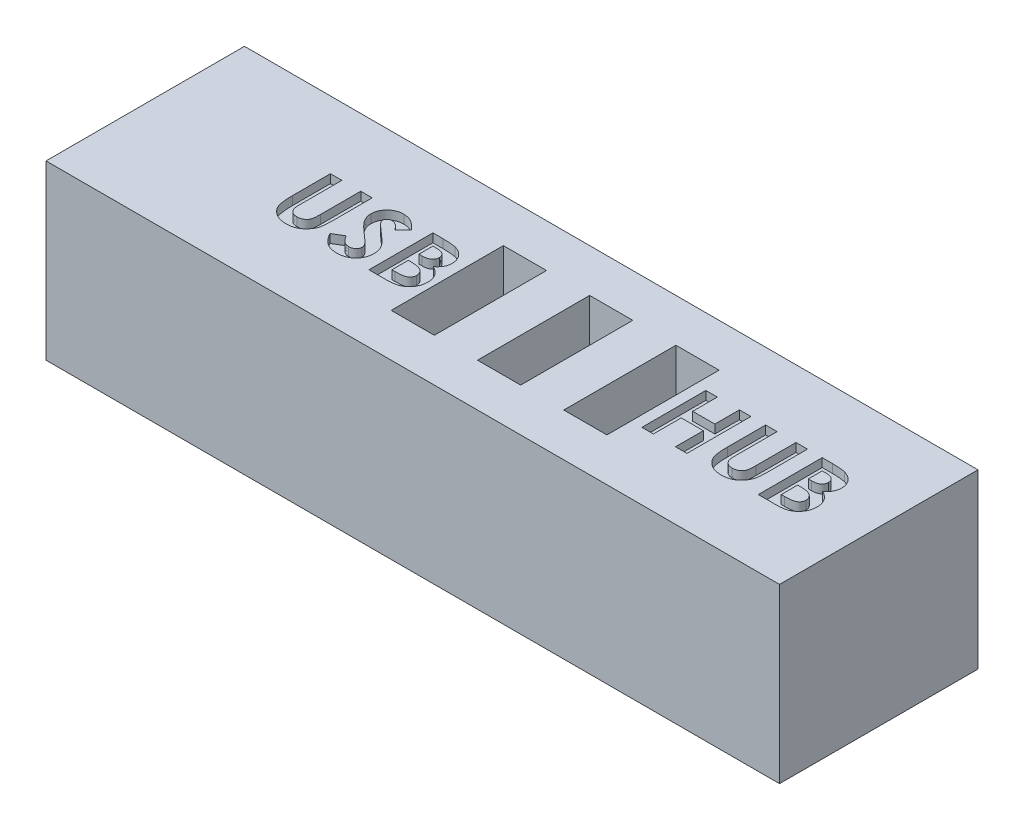
from build123d import *

# Parameters (mm, degrees)
SKETCH1_W           = 85
SKETCH1_H           = 23
BOSS_EXTRUDE1_DEPTH = 20
SKETCH2_W           = 5
SKETCH2_H           = 13
CUT_EXTRUDE1_DEPTH  = 10
CUT_EXTRUDE2_DEPTH  = 1


with BuildPart() as part:
    # Sketch1 → Boss-Extrude1 (new body)
    with BuildSketch(Plane(origin=(0, 0, 0), x_dir=(1, 0, 0), z_dir=(0, 1, 0))):
        Rectangle(SKETCH1_W, SKETCH1_H)
    extrude(amount=BOSS_EXTRUDE1_DEPTH)

    # Sketch2 → Cut-Extrude1 (cut)
    with BuildSketch(Plane(origin=(0, 20, 0), x_dir=(1, 0, 0), z_dir=(0, 1, 0))):
        with Locations((5, 0)):
            Rectangle(SKETCH2_W, SKETCH2_H)
        with Locations((-5, 0)):
            Rectangle(SKETCH2_W, SKETCH2_H)
        with Locations((15, 0)):
            Rectangle(SKETCH2_W, SKETCH2_H)
    extrude(amount=-CUT_EXTRUDE1_DEPTH, mode=Mode.SUBTRACT)

    # Sketch3 → Cut-Extrude2 (cut)
    # profile 1 of 6: a face of its own
    with BuildSketch(Plane(origin=(0, 20, 0), x_dir=(1, 0, 0), z_dir=(0, 1, 0))):
        with BuildLine():
            Line((-24.734192762, 3.694715282), (-23.404491907, 3.694715282))
            Line((-23.404491907, 3.694715282), (-23.404491907, -1.125450317))
            add(Edge.make_bspline(
                [(-23.404491907, -1.125450317), (-23.404419604, -1.175423703), (-23.404279953, -1.271946782), (-23.397288917, -1.410425799), (-23.390891637, -1.53771701), (-23.379349129, -1.653681058), (-23.362296888, -1.758367549), (-23.345784754, -1.852448951), (-23.323437214, -1.934240844), (-23.289852434, -2.027341432), (-23.238109313, -2.131945027), (-23.153563925, -2.240965294), (-23.056005779, -2.340462111), (-22.939076722, -2.423279492), (-22.807658803, -2.490271288), (-22.662474105, -2.539904796), (-22.503727286, -2.567494436), (-22.393962569, -2.5717065), (-22.337466333, -2.573874462)],
                knots=[0, 0, 0, 0, 1.155499968, 2.231836252, 3.205919964, 4.102923608, 4.924856345, 5.658536265, 6.31071849, 6.882491295, 7.94666036, 8.992281882, 10.060072772, 11.158554251, 12.289267114, 13.461410017, 14.693379945, 16, 16, 16, 16], degree=3))
            add(Edge.make_bspline(
                [(-22.337466333, -2.573874462), (-22.277446053, -2.572123027), (-22.16041667, -2.568708025), (-21.992088532, -2.535186083), (-21.836131558, -2.48180767), (-21.695847889, -2.405623072), (-21.571377129, -2.31430248), (-21.466015239, -2.210168388), (-21.382864022, -2.0930131), (-21.328669153, -1.984928425), (-21.298241402, -1.885445894), (-21.275434288, -1.796562028), (-21.258714149, -1.691687864), (-21.243545091, -1.572461239), (-21.234429655, -1.437647194), (-21.224545451, -1.288329921), (-21.220922798, -1.123487752), (-21.220305344, -1.008705056), (-21.21998336, -0.948849422)],
                knots=[0, 0, 0, 0, 1.261321664, 2.459363699, 3.594844139, 4.716940403, 5.803436589, 6.833651888, 7.818396249, 8.814403945, 9.360733334, 10.004355033, 10.743453831, 11.592799886, 12.532235708, 13.585170094, 14.740740724, 16, 16, 16, 16], degree=3))
            Line((-21.21998336, -0.948849422), (-21.21998336, 3.694715282))
            Line((-21.21998336, 3.694715282), (-19.890282505, 3.694715282))
            Line((-19.890282505, 3.694715282), (-19.890282505, -0.724759211))
            add(Edge.make_bspline(
                [(-19.890282505, -0.724759211), (-19.890467158, -0.814297553), (-19.890822228, -0.986471052), (-19.896275033, -1.233896487), (-19.907883066, -1.459879933), (-19.917632476, -1.664487421), (-19.936500922, -1.847443313), (-19.956157416, -2.009528881), (-19.981211309, -2.150169731), (-20.018489996, -2.310272247), (-20.082821973, -2.494624431), (-20.186533554, -2.70689798), (-20.318188693, -2.914726642), (-20.473798488, -3.115824159), (-20.649496181, -3.302637271), (-20.841386177, -3.466635003), (-21.046419822, -3.6053594), (-21.26673957, -3.715418483), (-21.502157918, -3.801256271), (-21.755004155, -3.85893494), (-22.02510586, -3.897903374), (-22.211670213, -3.901646771), (-22.30778551, -3.903575317)],
                knots=[0, 0, 0, 0, 1.170808336, 2.251350247, 3.235597562, 4.129743112, 4.929140599, 5.639994148, 6.264258765, 6.79612947, 7.788252245, 8.809469599, 9.879094798, 10.999557536, 12.129761673, 13.226370002, 14.293821979, 15.358369427, 16.438775801, 17.562147481, 18.744053101, 20, 20, 20, 20], degree=3))
            add(Edge.make_bspline(
                [(-22.30778551, -3.903575317), (-22.371646426, -3.902499664), (-22.497642703, -3.900377423), (-22.682942331, -3.881664802), (-22.862070822, -3.854089435), (-23.034691594, -3.813859814), (-23.201403782, -3.761890657), (-23.362163094, -3.697920245), (-23.516372109, -3.622305396), (-23.663167896, -3.535741602), (-23.80236981, -3.442137761), (-23.929593174, -3.338373963), (-24.049216043, -3.232123933), (-24.157782561, -3.118916218), (-24.25610816, -2.999939306), (-24.343990339, -2.874923557), (-24.421298533, -2.743880075), (-24.489977388, -2.604446809), (-24.548759784, -2.44953687), (-24.598315553, -2.273640046), (-24.641608639, -2.073999332), (-24.673781506, -1.850164947), (-24.702949616, -1.602874624), (-24.721411421, -1.331484134), (-24.731069622, -1.035985691), (-24.73312541, -0.831122746), (-24.734192762, -0.724759211)],
                knots=[0, 0, 0, 0, 1.001158378, 1.975264943, 2.917723546, 3.841610987, 4.75185031, 5.653588123, 6.552117133, 7.442167995, 8.324307438, 9.179605724, 10.014504199, 10.831958861, 11.636465792, 12.43274043, 13.225645099, 14.020104002, 14.867201867, 15.819789774, 16.883317127, 18.068162734, 19.364263498, 20.787406516, 22.332041935, 24, 24, 24, 24], degree=3))
            Line((-24.734192762, -0.724759211), (-24.734192762, 3.694715282))
        make_face()
    # profile 2 of 6: a face of its own
    with BuildSketch(Plane(origin=(0, 20, 0), x_dir=(1, 0, 0), z_dir=(0, 1, 0))):
        with BuildLine():
            Line((-14.381521821, 2.704859846), (-15.37582938, 1.795142632))
            add(Edge.make_bspline(
                [(-15.37582938, 1.795142632), (-15.418421253, 1.855222896), (-15.500191708, 1.970568624), (-15.632733087, 2.125019273), (-15.764675974, 2.25677717), (-15.897242739, 2.365291892), (-16.031608403, 2.449904132), (-16.167539729, 2.509810532), (-16.304266082, 2.5478936), (-16.396125085, 2.552635858), (-16.441370913, 2.554971692)],
                knots=[0, 0, 0, 0, 1.299362458, 2.494594718, 3.587462134, 4.587049575, 5.512617175, 6.380583204, 7.202344345, 8, 8, 8, 8], degree=3))
            add(Edge.make_bspline(
                [(-16.441370913, 2.554971692), (-16.483574924, 2.5534916), (-16.56505978, 2.550633932), (-16.681222487, 2.522228924), (-16.784353393, 2.473206051), (-16.874351846, 2.409104521), (-16.945643899, 2.331877038), (-17.002565075, 2.250885265), (-17.03461648, 2.161488665), (-17.038835076, 2.100087474), (-17.040923531, 2.069690242)],
                knots=[0, 0, 0, 0, 1.185010067, 2.2879431, 3.333075148, 4.379039566, 5.372662701, 6.27520591, 7.14612461, 8, 8, 8, 8], degree=3))
            add(Edge.make_bspline(
                [(-17.040923531, 2.069690242), (-17.039614802, 2.038854668), (-17.036979204, 1.976756108), (-17.011522913, 1.885742934), (-16.973153015, 1.796812469), (-16.936489011, 1.742676263), (-16.917748117, 1.715004411)],
                knots=[0, 0, 0, 0, 0.967525499, 1.948461899, 2.951351359, 4, 4, 4, 4], degree=3))
            add(Edge.make_bspline(
                [(-16.917748117, 1.715004411), (-16.900710617, 1.69349537), (-16.861492542, 1.643984398), (-16.786711705, 1.565566737), (-16.69280268, 1.469498237), (-16.576151648, 1.359082414), (-16.441601116, 1.230348282), (-16.282914492, 1.08835643), (-16.104659469, 0.928709534), (-15.977959928, 0.817537216), (-15.911568229, 0.759281922)],
                knots=[0, 0, 0, 0, 0.473873513, 1.090794244, 1.870441696, 2.795289791, 3.865433203, 5.087734844, 6.473946851, 8, 8, 8, 8], degree=3))
            add(Edge.make_bspline(
                [(-15.911568229, 0.759281922), (-15.849250069, 0.705348697), (-15.730983148, 0.602994643), (-15.562712805, 0.457719496), (-15.414831199, 0.327018989), (-15.285184032, 0.212854656), (-15.175736628, 0.114028653), (-15.086028871, 0.030068591), (-15.014965133, -0.03739098), (-14.974569558, -0.078136602), (-14.957329781, -0.095525771)],
                knots=[0, 0, 0, 0, 1.543621617, 2.929473131, 4.163658386, 5.240097082, 6.164993805, 6.925417477, 7.541396219, 8, 8, 8, 8], degree=3))
            add(Edge.make_bspline(
                [(-14.957329781, -0.095525771), (-14.89192566, -0.166307036), (-14.766195972, -0.302373487), (-14.6027917, -0.513233693), (-14.468304698, -0.719076249), (-14.364263003, -0.923774417), (-14.28568653, -1.130281584), (-14.230289076, -1.343662327), (-14.197111173, -1.566146342), (-14.193427651, -1.717964522), (-14.191564557, -1.794752867)],
                knots=[0, 0, 0, 0, 1.206664779, 2.319633467, 3.337109185, 4.282041471, 5.190008762, 6.099243693, 7.03861361, 8, 8, 8, 8], degree=3))
            add(Edge.make_bspline(
                [(-14.191564557, -1.794752867), (-14.192890659, -1.869573693), (-14.195492522, -2.016374937), (-14.227360352, -2.231196691), (-14.272802007, -2.436790432), (-14.343062777, -2.630919011), (-14.428696188, -2.81676899), (-14.536050037, -2.991445415), (-14.662122411, -3.156716084), (-14.80662071, -3.309626582), (-14.966452987, -3.44838226), (-15.137888294, -3.571905842), (-15.322603012, -3.673890293), (-15.519018968, -3.757867214), (-15.727031024, -3.822547361), (-15.946391376, -3.870352018), (-16.17743555, -3.89904362), (-16.335426885, -3.902042987), (-16.416142214, -3.903575317)],
                knots=[0, 0, 0, 0, 1.043214005, 2.046824704, 3.02475056, 3.976699089, 4.921714032, 5.875962561, 6.831408892, 7.817874052, 8.806269674, 9.781291748, 10.760897367, 11.74438705, 12.757449933, 13.795994037, 14.874007457, 16, 16, 16, 16], degree=3))
            add(Edge.make_bspline(
                [(-16.416142214, -3.903575317), (-16.47950306, -3.902451253), (-16.604993871, -3.900224962), (-16.789948356, -3.882049153), (-16.968542819, -3.85271533), (-17.140576089, -3.810671198), (-17.306823207, -3.757395582), (-17.467291001, -3.692321457), (-17.620871707, -3.6144402), (-17.768727391, -3.525353358), (-17.910139291, -3.4219118), (-18.046895505, -3.306230354), (-18.17763764, -3.176529788), (-18.302993625, -3.033116839), (-18.422161397, -2.875585396), (-18.539041744, -2.706129375), (-18.648440153, -2.521603904), (-18.716020417, -2.392157793), (-18.750538915, -2.326039593)],
                knots=[0, 0, 0, 0, 1.016823716, 2.013894106, 2.979844003, 3.91962641, 4.853723003, 5.779685073, 6.695824784, 7.614987388, 8.547259901, 9.504950863, 10.487499108, 11.500346958, 12.559593716, 13.656357062, 14.802919212, 16, 16, 16, 16], degree=3))
            Line((-18.750538915, -2.326039593), (-17.581114503, -1.624088137))
            add(Edge.make_bspline(
                [(-17.581114503, -1.624088137), (-17.537937021, -1.699140933), (-17.455162096, -1.843023557), (-17.314892249, -2.036348098), (-17.171192951, -2.201898567), (-17.020742004, -2.336748848), (-16.865368835, -2.442702062), (-16.704322956, -2.51842358), (-16.537491218, -2.565295114), (-16.423853017, -2.57101921), (-16.367168857, -2.573874462)],
                knots=[0, 0, 0, 0, 1.283663364, 2.460892379, 3.537111102, 4.529833553, 5.449777664, 6.316464042, 7.160231139, 8, 8, 8, 8], degree=3))
            add(Edge.make_bspline(
                [(-16.367168857, -2.573874462), (-16.30951295, -2.571542709), (-16.197652095, -2.567018768), (-16.037985037, -2.525232493), (-15.891596234, -2.459624977), (-15.765058833, -2.366012097), (-15.65791494, -2.257968606), (-15.578836597, -2.137765282), (-15.529159049, -2.007708187), (-15.523906927, -1.917361974), (-15.521265411, -1.871923006)],
                knots=[0, 0, 0, 0, 1.13588714, 2.203786484, 3.234766741, 4.283437687, 5.291419208, 6.222934724, 7.106237994, 8, 8, 8, 8], degree=3))
            add(Edge.make_bspline(
                [(-15.521265411, -1.871923006), (-15.523704743, -1.829649441), (-15.528660013, -1.743774739), (-15.565158999, -1.616092866), (-15.622218049, -1.488469061), (-15.689722927, -1.383788563), (-15.758417594, -1.29614242), (-15.82410519, -1.220201001), (-15.904095305, -1.136299029), (-15.99818512, -1.04433096), (-16.105131463, -0.943487176), (-16.225024422, -0.833777553), (-16.359236898, -0.716168501), (-16.454098541, -0.636054377), (-16.503700641, -0.594163591)],
                knots=[0, 0, 0, 0, 0.916159276, 1.861089862, 2.860218735, 3.940849679, 4.552606315, 5.27541173, 6.11797699, 7.06649574, 8.129236253, 9.306560635, 10.591630461, 12, 12, 12, 12], degree=3))
            add(Edge.make_bspline(
                [(-16.503700641, -0.594163591), (-16.597996207, -0.5143805), (-16.77897794, -0.361252599), (-17.03472809, -0.135087511), (-17.265181874, 0.076284488), (-17.468348847, 0.275476417), (-17.64681767, 0.458809662), (-17.799379674, 0.627773327), (-17.924358897, 0.783670735), (-18.05587258, 0.968320782), (-18.180836873, 1.193329552), (-18.288841484, 1.464041186), (-18.358910318, 1.734718471), (-18.366760556, 1.916436292), (-18.370624386, 2.005876473)],
                knots=[0, 0, 0, 0, 1.345494975, 2.582412109, 3.71882943, 4.751509156, 5.681369928, 6.505683931, 7.230279997, 7.856715994, 8.973648664, 10.023341002, 11.027102913, 12, 12, 12, 12], degree=3))
            add(Edge.make_bspline(
                [(-18.370624386, 2.005876473), (-18.369017424, 2.069302649), (-18.365851537, 2.194259028), (-18.337611336, 2.377989177), (-18.295405279, 2.555273333), (-18.234109968, 2.725464683), (-18.154556055, 2.888350056), (-18.057940918, 3.044726843), (-17.942764307, 3.193155788), (-17.812968042, 3.333538493), (-17.66996579, 3.46183231), (-17.51714971, 3.575064459), (-17.355384755, 3.670701978), (-17.185660522, 3.750040245), (-17.0069253, 3.810768648), (-16.820495823, 3.853815968), (-16.626104691, 3.87941914), (-16.49388404, 3.882899594), (-16.426530502, 3.884672547)],
                knots=[0, 0, 0, 0, 1.010766082, 1.991317756, 2.957454644, 3.913069143, 4.869106762, 5.843196583, 6.838735724, 7.860187025, 8.887984031, 9.89767229, 10.887916223, 11.879572884, 12.879850636, 13.892031539, 14.926195476, 16, 16, 16, 16], degree=3))
            add(Edge.make_bspline(
                [(-16.426530502, 3.884672547), (-16.33924365, 3.881479408), (-16.165358959, 3.875118335), (-15.908265428, 3.825376827), (-15.657147216, 3.747153066), (-15.454791454, 3.652784705), (-15.293780752, 3.561370028), (-15.170381089, 3.477206909), (-15.04481529, 3.380793533), (-14.916070744, 3.271826076), (-14.786539725, 3.148251447), (-14.652539046, 3.013011438), (-14.51589463, 2.86493726), (-14.427097425, 2.759153753), (-14.381521821, 2.704859846)],
                knots=[0, 0, 0, 0, 1.282922637, 2.555718331, 3.837320111, 5.142675274, 5.830281639, 6.55870424, 7.337177975, 8.157850921, 9.037902056, 9.96903443, 10.957596896, 12, 12, 12, 12], degree=3))
        make_face()
    # profile 3 of 6: a face of its own
    with BuildSketch(Plane(origin=(0, 20, 0), x_dir=(1, 0, 0), z_dir=(0, 1, 0))):
        with BuildLine():
            Line((-12.861863702, -3.713618052), (-12.861863702, 3.694715282))
            Line((-12.861863702, 3.694715282), (-11.674630796, 3.694715282))
            add(Edge.make_bspline(
                [(-11.674630796, 3.694715282), (-11.591517069, 3.694724767), (-11.430693583, 3.694743121), (-11.198667264, 3.686595118), (-10.983482449, 3.676054764), (-10.785823938, 3.664262559), (-10.605355304, 3.643942234), (-10.442350978, 3.62252683), (-10.296485276, 3.596701174), (-10.20630444, 3.573534759), (-10.163876923, 3.562635621)],
                knots=[0, 0, 0, 0, 1.311965854, 2.538629056, 3.664479157, 4.713267157, 5.663616078, 6.530575999, 7.308677837, 8, 8, 8, 8], degree=3))
            add(Edge.make_bspline(
                [(-10.163876923, 3.562635621), (-10.108165286, 3.547262192), (-9.998841169, 3.517094589), (-9.842254146, 3.456169812), (-9.693709512, 3.388447602), (-9.553388636, 3.311189227), (-9.422153144, 3.223461962), (-9.300501776, 3.124569575), (-9.185810812, 3.018481605), (-9.082152667, 2.902241408), (-8.988462783, 2.779412108), (-8.907063072, 2.650025889), (-8.836337155, 2.516061151), (-8.779737897, 2.375832037), (-8.737091419, 2.22998434), (-8.705899963, 2.079140852), (-8.685683676, 1.922824267), (-8.683773502, 1.816476985), (-8.682803873, 1.762493727)],
                knots=[0, 0, 0, 0, 1.099996261, 2.158545794, 3.195537121, 4.207578794, 5.205712374, 6.197378256, 7.190519799, 8.17788031, 9.159561366, 10.129234751, 11.085776129, 12.040971148, 13.00380137, 13.975669004, 14.972423361, 16, 16, 16, 16], degree=3))
            add(Edge.make_bspline(
                [(-8.682803873, 1.762493727), (-8.685339165, 1.69313941), (-8.690329575, 1.556623959), (-8.722208659, 1.35610746), (-8.781986906, 1.166590547), (-8.86020529, 0.984580495), (-8.966557837, 0.810756204), (-9.101605003, 0.645200322), (-9.263159467, 0.482815134), (-9.387080658, 0.385476167), (-9.451537179, 0.334846158)],
                knots=[0, 0, 0, 0, 0.986156485, 1.941127874, 2.875419072, 3.804401753, 4.751181392, 5.761612777, 6.835722519, 8, 8, 8, 8], degree=3))
            add(Edge.make_bspline(
                [(-9.451537179, 0.334846158), (-9.399304707, 0.308181934), (-9.29689128, 0.255900767), (-9.1514943, 0.169966136), (-9.016872569, 0.078563757), (-8.892422482, -0.016467317), (-8.780754522, -0.119155591), (-8.677257734, -0.223584026), (-8.587038109, -0.335735936), (-8.506361002, -0.451614015), (-8.436237772, -0.57289619), (-8.375168171, -0.699377643), (-8.32358487, -0.831490463), (-8.279902796, -0.9685623), (-8.247324693, -1.11106462), (-8.226083078, -1.259048386), (-8.20981917, -1.412008899), (-8.20855399, -1.516201781), (-8.20791071, -1.569178615)],
                knots=[0, 0, 0, 0, 1.164658916, 2.283573913, 3.35186032, 4.395461096, 5.390182219, 6.362969632, 7.312859996, 8.245001507, 9.165155236, 10.092416118, 11.032087915, 11.979892451, 12.947605196, 13.931445124, 14.948243989, 16, 16, 16, 16], degree=3))
            add(Edge.make_bspline(
                [(-8.20791071, -1.569178615), (-8.212085167, -1.67036134), (-8.220323441, -1.870045042), (-8.28055768, -2.163226577), (-8.384984711, -2.441189264), (-8.525208681, -2.70282836), (-8.69799159, -2.940569842), (-8.896642387, -3.148829317), (-9.119161115, -3.325116339), (-9.324461536, -3.444096403), (-9.502030232, -3.523943152), (-9.649107066, -3.573309447), (-9.807064468, -3.619042309), (-9.978795838, -3.651156868), (-10.161187921, -3.680551645), (-10.356019051, -3.698700588), (-10.562925093, -3.71099968), (-10.705037106, -3.712727616), (-10.778269952, -3.713618052)],
                knots=[0, 0, 0, 0, 1.284142165, 2.534249414, 3.780121997, 5.041676246, 6.291546858, 7.49970053, 8.684500223, 9.883330709, 10.50184324, 11.153274765, 11.851151195, 12.587658647, 13.369265475, 14.195992086, 15.070362669, 16, 16, 16, 16], degree=3))
            Line((-10.778269952, -3.713618052), (-12.861863702, -3.713618052))
        make_face()
        with BuildLine():
            Line((-11.532162847, 2.365014427), (-11.532162847, 0.750377675))
            Line((-11.532162847, 0.750377675), (-11.178961058, 0.750377675))
            add(Edge.make_bspline(
                [(-11.178961058, 0.750377675), (-11.130957761, 0.750796282), (-11.038290302, 0.751604377), (-10.904441987, 0.762012364), (-10.77998467, 0.779769036), (-10.66539039, 0.804544061), (-10.559591661, 0.83600473), (-10.463264354, 0.87385869), (-10.376832005, 0.920044635), (-10.276417605, 0.98884064), (-10.170272343, 1.09007704), (-10.076833863, 1.236333996), (-10.021799222, 1.404528939), (-10.015669847, 1.523153036), (-10.012504727, 1.584408791)],
                knots=[0, 0, 0, 0, 1.065314748, 2.056525647, 2.977365736, 3.853934255, 4.656397591, 5.425096493, 6.14721249, 6.826394842, 8.123232004, 9.372140726, 10.643011755, 12, 12, 12, 12], degree=3))
            add(Edge.make_bspline(
                [(-10.012504727, 1.584408791), (-10.015037403, 1.641784984), (-10.019934229, 1.752719547), (-10.075347036, 1.908481552), (-10.161414081, 2.046518568), (-10.263028325, 2.140993617), (-10.35871788, 2.20551729), (-10.44065315, 2.248003381), (-10.530583261, 2.286036495), (-10.630249164, 2.315117541), (-10.739081712, 2.336938934), (-10.856552244, 2.352964134), (-10.982863438, 2.363871567), (-11.070106849, 2.364625302), (-11.115147289, 2.365014427)],
                knots=[0, 0, 0, 0, 1.347982417, 2.606269829, 3.849316587, 5.153353503, 5.842674298, 6.568177932, 7.326619318, 8.142485038, 9.012069166, 9.942760135, 10.937925643, 12, 12, 12, 12], degree=3))
            Line((-11.115147289, 2.365014427), (-11.532162847, 2.365014427))
        make_face(mode=Mode.SUBTRACT)
        with BuildLine():
            Line((-11.532162847, -0.484344547), (-11.532162847, -2.383917197))
            Line((-11.532162847, -2.383917197), (-11.149280235, -2.383917197))
            add(Edge.make_bspline(
                [(-11.149280235, -2.383917197), (-11.073583855, -2.383484746), (-10.928048119, -2.382653306), (-10.719568435, -2.372607531), (-10.530008282, -2.35450179), (-10.359869923, -2.331898232), (-10.20889276, -2.301273946), (-10.07758713, -2.262339092), (-9.964152348, -2.21950397), (-9.869268574, -2.166597509), (-9.791753967, -2.105027507), (-9.721805161, -2.042101487), (-9.664773263, -1.969510378), (-9.619648561, -1.890370315), (-9.580593211, -1.806647194), (-9.557037782, -1.715071658), (-9.539103505, -1.618357785), (-9.538116533, -1.551462891), (-9.537611565, -1.517237175)],
                knots=[0, 0, 0, 0, 1.753078804, 3.370512758, 4.83203934, 6.162291463, 7.344201807, 8.395507345, 9.331626367, 10.147333109, 10.898971645, 11.62040215, 12.321813352, 13.025280112, 13.727906689, 14.453419512, 15.208716525, 16, 16, 16, 16], degree=3))
            add(Edge.make_bspline(
                [(-9.537611565, -1.517237175), (-9.538725165, -1.478099531), (-9.540894158, -1.401869929), (-9.558608351, -1.290452229), (-9.590800826, -1.186436414), (-9.631348819, -1.087162659), (-9.687773506, -0.996185309), (-9.754832317, -0.910355985), (-9.835856481, -0.832581131), (-9.92697288, -0.758156634), (-10.033251139, -0.692993955), (-10.154741119, -0.636453788), (-10.292102821, -0.589233524), (-10.445761737, -0.551636718), (-10.615044239, -0.519728828), (-10.801185902, -0.500676296), (-11.002636475, -0.48650609), (-11.142325581, -0.485081433), (-11.214578045, -0.484344547)],
                knots=[0, 0, 0, 0, 0.845221588, 1.646264278, 2.427170338, 3.19324141, 3.95557735, 4.731569926, 5.540061037, 6.376114724, 7.268642756, 8.224665384, 9.265483498, 10.400594375, 11.639216012, 12.983232105, 14.439614077, 16, 16, 16, 16], degree=3))
            Line((-11.214578045, -0.484344547), (-11.532162847, -0.484344547))
        make_face(mode=Mode.SUBTRACT)
    # profile 4 of 6: a face of its own
    with BuildSketch(Plane(origin=(0, 20, 0), x_dir=(1, 0, 0), z_dir=(0, 1, 0))):
        Polygon((18.766020914, 3.694715282), (20.095721768, 3.694715282), (20.095721768, 0.845356307), (22.660144845, 0.845356307), (22.660144845, 3.694715282), (23.9898457, 3.694715282), (23.9898457, -3.713618052), (22.660144845, -3.713618052), (22.660144845, -0.484344547), (20.095721768, -0.484344547), (20.095721768, -3.713618052), (18.766020914, -3.713618052), align=None)
    # profile 5 of 6: a face of its own
    with BuildSketch(Plane(origin=(0, 20, 0), x_dir=(1, 0, 0), z_dir=(0, 1, 0))):
        with BuildLine():
            Line((25.699461085, 3.694715282), (27.029161939, 3.694715282))
            Line((27.029161939, 3.694715282), (27.029161939, -1.125450317))
            add(Edge.make_bspline(
                [(27.029161939, -1.125450317), (27.029234242, -1.175423703), (27.029373893, -1.271946782), (27.036364929, -1.410425799), (27.042762209, -1.53771701), (27.054304717, -1.653681058), (27.071356958, -1.758367549), (27.087869092, -1.852448951), (27.110216632, -1.934240844), (27.143801412, -2.027341432), (27.195544533, -2.131945027), (27.280089921, -2.240965294), (27.377648067, -2.340462111), (27.494577124, -2.423279492), (27.625995043, -2.490271288), (27.771179741, -2.539904796), (27.92992656, -2.567494436), (28.039691277, -2.5717065), (28.096187513, -2.573874462)],
                knots=[0, 0, 0, 0, 1.155499968, 2.231836252, 3.205919964, 4.102923608, 4.924856345, 5.658536265, 6.31071849, 6.882491295, 7.94666036, 8.992281882, 10.060072772, 11.158554251, 12.289267114, 13.461410017, 14.693379945, 16, 16, 16, 16], degree=3))
            add(Edge.make_bspline(
                [(28.096187513, -2.573874462), (28.156207793, -2.572123027), (28.273237176, -2.568708025), (28.441565314, -2.535186083), (28.597522288, -2.48180767), (28.737805957, -2.405623072), (28.862276717, -2.31430248), (28.967638607, -2.210168388), (29.050789824, -2.0930131), (29.104984694, -1.984928425), (29.135412444, -1.885445894), (29.158219559, -1.796562028), (29.174939697, -1.691687864), (29.190108756, -1.572461239), (29.199224191, -1.437647194), (29.209108395, -1.288329921), (29.212731048, -1.123487752), (29.213348503, -1.008705056), (29.213670486, -0.948849422)],
                knots=[0, 0, 0, 0, 1.261321664, 2.459363699, 3.594844139, 4.716940403, 5.803436589, 6.833651888, 7.818396249, 8.814403945, 9.360733334, 10.004355033, 10.743453831, 11.592799886, 12.532235708, 13.585170094, 14.740740724, 16, 16, 16, 16], degree=3))
            Line((29.213670486, -0.948849422), (29.213670486, 3.694715282))
            Line((29.213670486, 3.694715282), (30.543371341, 3.694715282))
            Line((30.543371341, 3.694715282), (30.543371341, -0.724759211))
            add(Edge.make_bspline(
                [(30.543371341, -0.724759211), (30.543186688, -0.814297553), (30.542831618, -0.986471052), (30.537378814, -1.233896487), (30.52577078, -1.459879933), (30.51602137, -1.664487421), (30.497152924, -1.847443313), (30.47749643, -2.009528881), (30.452442537, -2.150169731), (30.41516385, -2.310272247), (30.350831873, -2.494624431), (30.247120292, -2.70689798), (30.115465153, -2.914726642), (29.959855358, -3.115824159), (29.784157666, -3.302637271), (29.592267669, -3.466635003), (29.387234024, -3.6053594), (29.166914276, -3.715418483), (28.931495928, -3.801256271), (28.678649691, -3.85893494), (28.408547986, -3.897903374), (28.221983634, -3.901646771), (28.125868336, -3.903575317)],
                knots=[0, 0, 0, 0, 1.170808336, 2.251350247, 3.235597562, 4.129743112, 4.929140599, 5.639994148, 6.264258765, 6.79612947, 7.788252245, 8.809469599, 9.879094798, 10.999557536, 12.129761673, 13.226370002, 14.293821979, 15.358369427, 16.438775801, 17.562147481, 18.744053101, 20, 20, 20, 20], degree=3))
            add(Edge.make_bspline(
                [(28.125868336, -3.903575317), (28.06200742, -3.902499664), (27.936011144, -3.900377423), (27.750711515, -3.881664802), (27.571583024, -3.854089435), (27.398962252, -3.813859814), (27.232250064, -3.761890657), (27.071490752, -3.697920245), (26.917281737, -3.622305396), (26.77048595, -3.535741602), (26.631284036, -3.442137761), (26.504060672, -3.338373963), (26.384437804, -3.232123933), (26.275871285, -3.118916218), (26.177545686, -2.999939306), (26.089663508, -2.874923557), (26.012355313, -2.743880075), (25.943676459, -2.604446809), (25.884894062, -2.44953687), (25.835338293, -2.273640046), (25.792045207, -2.073999332), (25.759872341, -1.850164947), (25.730704231, -1.602874624), (25.712242425, -1.331484134), (25.702584224, -1.035985691), (25.700528436, -0.831122746), (25.699461085, -0.724759211)],
                knots=[0, 0, 0, 0, 1.001158378, 1.975264943, 2.917723546, 3.841610987, 4.75185031, 5.653588123, 6.552117133, 7.442167995, 8.324307438, 9.179605724, 10.014504199, 10.831958861, 11.636465792, 12.43274043, 13.225645099, 14.020104002, 14.867201867, 15.819789774, 16.883317127, 18.068162734, 19.364263498, 20.787406516, 22.332041935, 24, 24, 24, 24], degree=3))
            Line((25.699461085, -0.724759211), (25.699461085, 3.694715282))
        make_face()
    # profile 6 of 6: a face of its own
    with BuildSketch(Plane(origin=(0, 20, 0), x_dir=(1, 0, 0), z_dir=(0, 1, 0))):
        with BuildLine():
            Line((32.252986726, -3.713618052), (32.252986726, 3.694715282))
            Line((32.252986726, 3.694715282), (33.440219632, 3.694715282))
            add(Edge.make_bspline(
                [(33.440219632, 3.694715282), (33.523333358, 3.694724767), (33.684156844, 3.694743121), (33.916183163, 3.686595118), (34.131367979, 3.676054764), (34.329026489, 3.664262559), (34.509495124, 3.643942234), (34.67249945, 3.62252683), (34.818365151, 3.596701174), (34.908545988, 3.573534759), (34.950973504, 3.562635621)],
                knots=[0, 0, 0, 0, 1.311965854, 2.538629056, 3.664479157, 4.713267157, 5.663616078, 6.530575999, 7.308677837, 8, 8, 8, 8], degree=3))
            add(Edge.make_bspline(
                [(34.950973504, 3.562635621), (35.006685141, 3.547262192), (35.116009258, 3.517094589), (35.272596281, 3.456169812), (35.421140915, 3.388447602), (35.561461791, 3.311189227), (35.692697283, 3.223461962), (35.814348651, 3.124569575), (35.929039615, 3.018481605), (36.03269776, 2.902241408), (36.126387644, 2.779412108), (36.207787356, 2.650025889), (36.278513272, 2.516061151), (36.335112531, 2.375832037), (36.377759008, 2.22998434), (36.408950464, 2.079140852), (36.429166752, 1.922824267), (36.431076926, 1.816476985), (36.432046555, 1.762493727)],
                knots=[0, 0, 0, 0, 1.099996261, 2.158545794, 3.195537121, 4.207578794, 5.205712374, 6.197378256, 7.190519799, 8.17788031, 9.159561366, 10.129234751, 11.085776129, 12.040971148, 13.00380137, 13.975669004, 14.972423361, 16, 16, 16, 16], degree=3))
            add(Edge.make_bspline(
                [(36.432046555, 1.762493727), (36.429511263, 1.69313941), (36.424520852, 1.556623959), (36.392641769, 1.35610746), (36.332863521, 1.166590547), (36.254645137, 0.984580495), (36.14829259, 0.810756204), (36.013245424, 0.645200322), (35.851690961, 0.482815134), (35.727769769, 0.385476167), (35.663313248, 0.334846158)],
                knots=[0, 0, 0, 0, 0.986156485, 1.941127874, 2.875419072, 3.804401753, 4.751181392, 5.761612777, 6.835722519, 8, 8, 8, 8], degree=3))
            add(Edge.make_bspline(
                [(35.663313248, 0.334846158), (35.71554572, 0.308181934), (35.817959148, 0.255900767), (35.963356127, 0.169966136), (36.097977859, 0.078563757), (36.222427946, -0.016467317), (36.334095905, -0.119155591), (36.437592694, -0.223584026), (36.527812318, -0.335735936), (36.608489425, -0.451614015), (36.678612655, -0.57289619), (36.739682256, -0.699377643), (36.791265558, -0.831490463), (36.834947632, -0.9685623), (36.867525734, -1.11106462), (36.888767349, -1.259048386), (36.905031258, -1.412008899), (36.906296437, -1.516201781), (36.906939717, -1.569178615)],
                knots=[0, 0, 0, 0, 1.164658916, 2.283573913, 3.35186032, 4.395461096, 5.390182219, 6.362969632, 7.312859996, 8.245001507, 9.165155236, 10.092416118, 11.032087915, 11.979892451, 12.947605196, 13.931445124, 14.948243989, 16, 16, 16, 16], degree=3))
            add(Edge.make_bspline(
                [(36.906939717, -1.569178615), (36.90276526, -1.67036134), (36.894526986, -1.870045042), (36.834292747, -2.163226577), (36.729865716, -2.441189264), (36.589641747, -2.70282836), (36.416858837, -2.940569842), (36.21820804, -3.148829317), (35.995689313, -3.325116339), (35.790388892, -3.444096403), (35.612820195, -3.523943152), (35.465743361, -3.573309447), (35.30778596, -3.619042309), (35.136054589, -3.651156868), (34.953662506, -3.680551645), (34.758831376, -3.698700588), (34.551925334, -3.71099968), (34.409813321, -3.712727616), (34.336580476, -3.713618052)],
                knots=[0, 0, 0, 0, 1.284142165, 2.534249414, 3.780121997, 5.041676246, 6.291546858, 7.49970053, 8.684500223, 9.883330709, 10.50184324, 11.153274765, 11.851151195, 12.587658647, 13.369265475, 14.195992086, 15.070362669, 16, 16, 16, 16], degree=3))
            Line((34.336580476, -3.713618052), (32.252986726, -3.713618052))
        make_face()
        with BuildLine():
            Line((33.58268758, 2.365014427), (33.58268758, 0.750377675))
            Line((33.58268758, 0.750377675), (33.93588937, 0.750377675))
            add(Edge.make_bspline(
                [(33.93588937, 0.750377675), (33.983892666, 0.750796282), (34.076560125, 0.751604377), (34.21040844, 0.762012364), (34.334865757, 0.779769036), (34.449460037, 0.804544061), (34.555258766, 0.83600473), (34.651586073, 0.87385869), (34.738018423, 0.920044635), (34.838432823, 0.98884064), (34.944578084, 1.09007704), (35.038016565, 1.236333996), (35.093051205, 1.404528939), (35.09918058, 1.523153036), (35.1023457, 1.584408791)],
                knots=[0, 0, 0, 0, 1.065314748, 2.056525647, 2.977365736, 3.853934255, 4.656397591, 5.425096493, 6.14721249, 6.826394842, 8.123232004, 9.372140726, 10.643011755, 12, 12, 12, 12], degree=3))
            add(Edge.make_bspline(
                [(35.1023457, 1.584408791), (35.099813025, 1.641784984), (35.094916199, 1.752719547), (35.039503391, 1.908481552), (34.953436346, 2.046518568), (34.851822103, 2.140993617), (34.756132547, 2.20551729), (34.674197278, 2.248003381), (34.584267167, 2.286036495), (34.484601264, 2.315117541), (34.375768716, 2.336938934), (34.258298183, 2.352964134), (34.131986989, 2.363871567), (34.044743579, 2.364625302), (33.999703138, 2.365014427)],
                knots=[0, 0, 0, 0, 1.347982417, 2.606269829, 3.849316587, 5.153353503, 5.842674298, 6.568177932, 7.326619318, 8.142485038, 9.012069166, 9.942760135, 10.937925643, 12, 12, 12, 12], degree=3))
            Line((33.999703138, 2.365014427), (33.58268758, 2.365014427))
        make_face(mode=Mode.SUBTRACT)
        with BuildLine():
            Line((33.58268758, -0.484344547), (33.58268758, -2.383917197))
            Line((33.58268758, -2.383917197), (33.965570192, -2.383917197))
            add(Edge.make_bspline(
                [(33.965570192, -2.383917197), (34.041266572, -2.383484746), (34.186802308, -2.382653306), (34.395281993, -2.372607531), (34.584842145, -2.35450179), (34.754980504, -2.331898232), (34.905957668, -2.301273946), (35.037263297, -2.262339092), (35.150698079, -2.21950397), (35.245581853, -2.166597509), (35.323096461, -2.105027507), (35.393045267, -2.042101487), (35.450077165, -1.969510378), (35.495201867, -1.890370315), (35.534257217, -1.806647194), (35.557812646, -1.715071658), (35.575746923, -1.618357785), (35.576733894, -1.551462891), (35.577238862, -1.517237175)],
                knots=[0, 0, 0, 0, 1.753078804, 3.370512758, 4.83203934, 6.162291463, 7.344201807, 8.395507345, 9.331626367, 10.147333109, 10.898971645, 11.62040215, 12.321813352, 13.025280112, 13.727906689, 14.453419512, 15.208716525, 16, 16, 16, 16], degree=3))
            add(Edge.make_bspline(
                [(35.577238862, -1.517237175), (35.576125262, -1.478099531), (35.573956269, -1.401869929), (35.556242076, -1.290452229), (35.524049601, -1.186436414), (35.483501608, -1.087162659), (35.427076922, -0.996185309), (35.36001811, -0.910355985), (35.278993946, -0.832581131), (35.187877547, -0.758156634), (35.081599289, -0.692993955), (34.960109308, -0.636453788), (34.822747606, -0.589233524), (34.66908869, -0.551636718), (34.499806188, -0.519728828), (34.313664525, -0.500676296), (34.112213952, -0.48650609), (33.972524847, -0.485081433), (33.900272383, -0.484344547)],
                knots=[0, 0, 0, 0, 0.845221588, 1.646264278, 2.427170338, 3.19324141, 3.95557735, 4.731569926, 5.540061037, 6.376114724, 7.268642756, 8.224665384, 9.265483498, 10.400594375, 11.639216012, 12.983232105, 14.439614077, 16, 16, 16, 16], degree=3))
            Line((33.900272383, -0.484344547), (33.58268758, -0.484344547))
        make_face(mode=Mode.SUBTRACT)
    extrude(amount=-CUT_EXTRUDE2_DEPTH, mode=Mode.SUBTRACT)


solid = part.part
